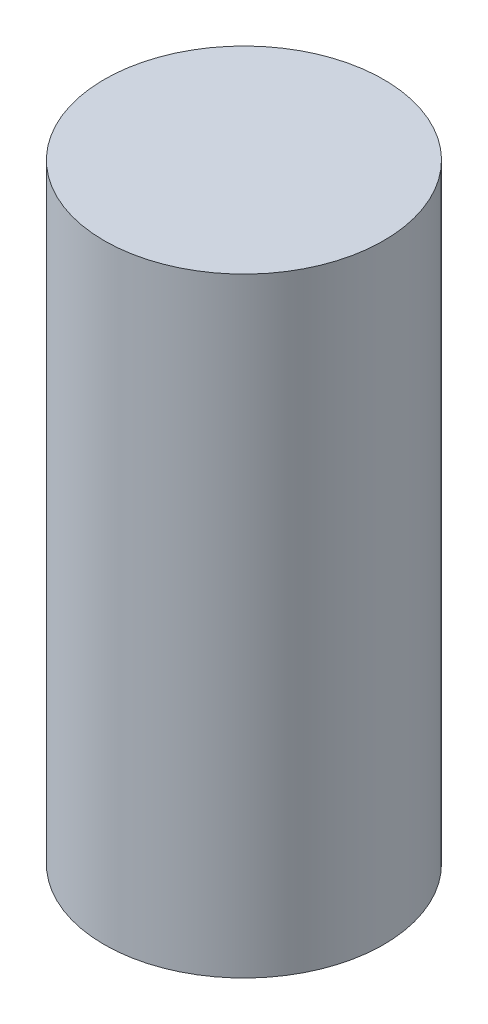
from build123d import *

# Parameters (mm, degrees)
SKETCH_1_R      = 5.5
EXTRUDE_1_DEPTH = 24


with BuildPart() as part:
    # 草图1 → 凸台-拉伸1 (new body)
    with BuildSketch(Plane(origin=(0, 0, 0), x_dir=(1, 0, 0), z_dir=(0, 1, 0))):
        with Locations(Location((0, 0, 0), (0, 0, 270))):
            Circle(SKETCH_1_R)
    extrude(amount=EXTRUDE_1_DEPTH)


solid = part.part
